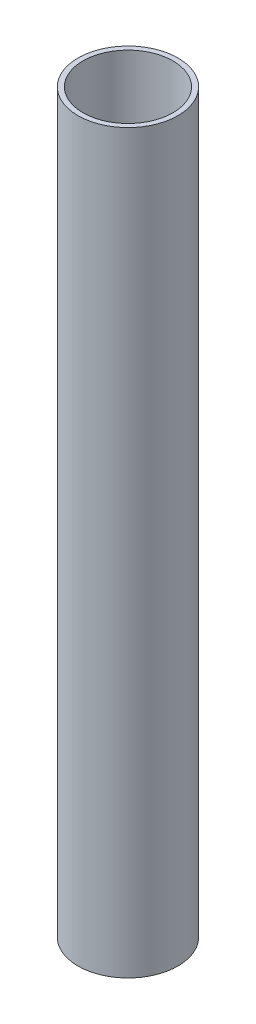
from build123d import *

# Parameters (mm, degrees)
SKETCH1_R           = 15
SKETCH1_R_2         = 13.5
BOSS_EXTRUDE1_DEPTH = 221


with BuildPart() as part:
    # Sketch1 → Boss-Extrude1 (new body)
    with BuildSketch(Plane(origin=(0, 0, 0), x_dir=(1, 0, 0), z_dir=(0, 1, 0))):
        with Locations(Location((0, 0, 0), (0, 0, 270))):
            Circle(SKETCH1_R)
        with Locations(Location((0, 0, 0), (0, 0, 270))):
            Circle(SKETCH1_R_2, mode=Mode.SUBTRACT)
    extrude(amount=BOSS_EXTRUDE1_DEPTH)


solid = part.part
